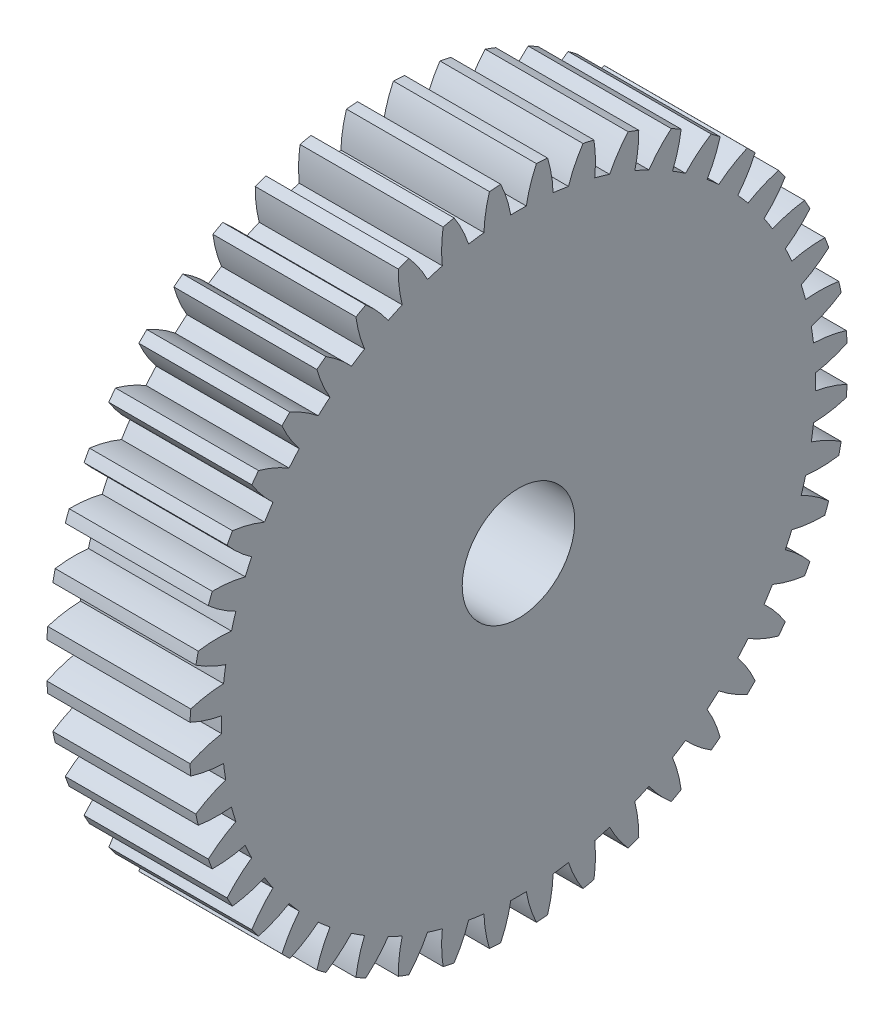
from build123d import *

# Parameters (mm, degrees)
BASPROSKE_W              = 12.7
BASPROSKE_H              = 29.21
TOOTHCUT_DEPTH           = 44.217336799
TEETHCUTS_COUNT          = 44
TEETHCUTS_ANGLE          = 351.818181818
BORSKE_R                 = 5
BORE_DEPTH               = 50.8018796
BOSS_EXTRUDE1_DEPTH      = 5.5
BOSS_EXTRUDE1_DEPTH_BACK = 1.27
SKETCH1_R                = 7.5
SKETCH1_R_2              = 1.49987
CUT_EXTRUDE1_DEPTH       = 46.084981868
CUT_EXTRUDE1_DEPTH_BACK  = 3
SKETCH2_R                = 2.875
FILLET1_R                = 5.08


with BuildPart() as part:
    # BasProSke → Base-Revolve (revolve)
    with BuildSketch(Plane(origin=(0, 0, 0), x_dir=(1, 0, 0), z_dir=(0, 1, 0)), mode=Mode.PRIVATE) as base_revolve_sk:
        with Locations((6.35, 14.605)):
            Rectangle(BASPROSKE_W, BASPROSKE_H)
    revolve(base_revolve_sk.sketch.rotate(Axis((-10, 0, 0), (1, 0, 0)), 180), axis=Axis((-10, 0, 0), (1, 0, 0)))

    # TooCutSke → ToothCut (cut, through all)
    with BuildSketch(Plane(origin=(0, 0, 0), x_dir=(0, 0, -1), z_dir=(1, 0, 0))):
        with BuildLine():
            ThreePointArc((0.689149635, 26.356191755), (0, 26.3652), (-0.689149635, 26.356191755))
            ThreePointArc((-0.689149635, 26.356191755), (-1.048738985, 27.804346662), (-1.598038384, 29.19169208))
            ThreePointArc((-1.598038384, 29.19169208), (0, 29.2354), (1.598038384, 29.19169208))
            ThreePointArc((1.598038384, 29.19169208), (1.048738985, 27.804346662), (0.689149635, 26.356191755))
        make_face()
    toothcut = extrude(amount=TOOTHCUT_DEPTH, mode=Mode.SUBTRACT)

    # TeethCuts: ToothCut ×44 about axis
    teethcuts_axis = Axis((-10, 0, 0), (1, 0, 0))
    for i in range(1, TEETHCUTS_COUNT):
        add(toothcut.rotate(teethcuts_axis, i * TEETHCUTS_ANGLE / (TEETHCUTS_COUNT - 1)), mode=Mode.SUBTRACT)

    # BorSke → Bore (cut, symmetric)
    with BuildSketch(Plane(origin=(0, 0, 0), x_dir=(0, 0, -1), z_dir=(1, 0, 0))):
        with Locations(Location((0, 0, 0), (0, 0, 180))):
            Circle(BORSKE_R)
    extrude(amount=BORE_DEPTH, both=True, mode=Mode.SUBTRACT)

    # Sketch1 → Boss-Extrude1 (add, two sides: drawn at the far end of the back side and taken through both)
    with BuildSketch(Plane.ZY.offset(-BOSS_EXTRUDE1_DEPTH_BACK)):
        Circle(SKETCH1_R)
        Circle(SKETCH1_R_2, mode=Mode.SUBTRACT)
    extrude(amount=BOSS_EXTRUDE1_DEPTH + BOSS_EXTRUDE1_DEPTH_BACK)

    # Sketch2 → Cut-Extrude1 (cut, two sides: drawn at the far end of the back side and taken through both)
    with BuildSketch(Plane.ZY.offset(5.5).offset(-CUT_EXTRUDE1_DEPTH_BACK)):
        with Locations(Location((0, 0, 0), (0, 0, 180))):
            Circle(SKETCH2_R)
    extrude(amount=CUT_EXTRUDE1_DEPTH + CUT_EXTRUDE1_DEPTH_BACK, mode=Mode.SUBTRACT)

    # Fillet1
    fillet1_edges = [part.edges().sort_by_distance(p)[0] for p in [
        (0, 0, -7.5),
    ]]
    fillet(fillet1_edges, radius=FILLET1_R)


solid = part.part
